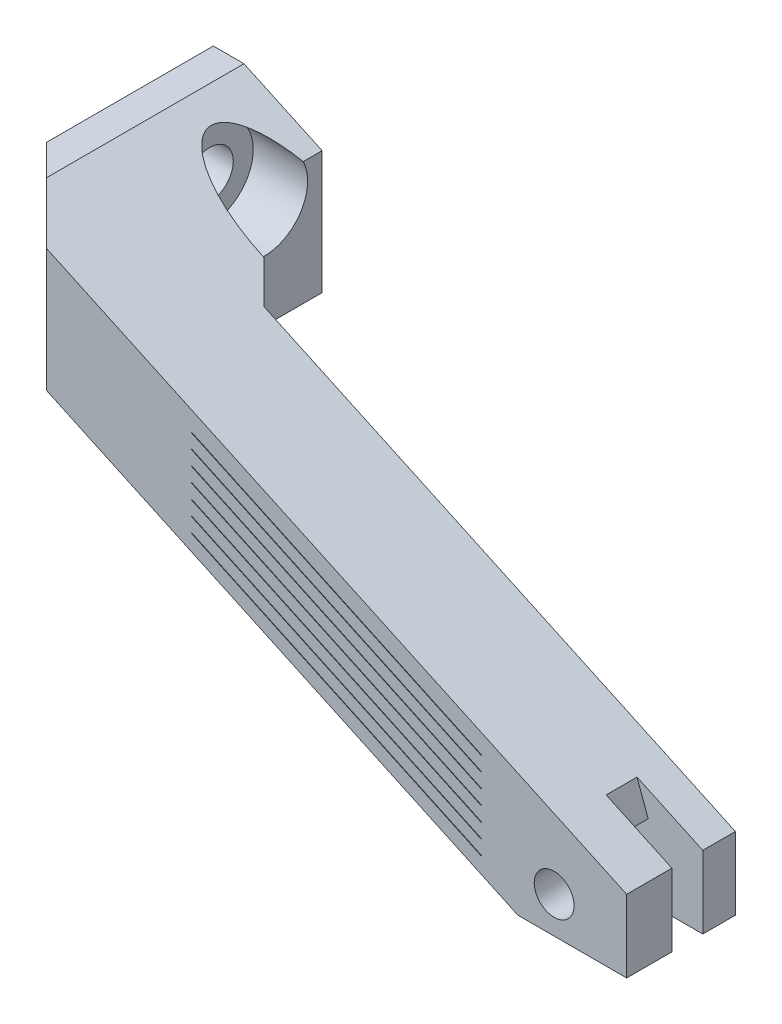
from build123d import *

# Parameters (mm, degrees)
BOSS_EXTRUDE1_DEPTH      = 10
BOSS_EXTRUDE1_DEPTH_BACK = 23
SKETCH2_W                = 75
SKETCH2_H                = 18
CUT_EXTRUDE1_DEPTH       = 106.405673062
SKETCH3_W                = 4.26
SKETCH3_H                = 10
CUT_EXTRUDE2_DEPTH       = 103.075500294
CHAMFER1_SIZE            = 10
SKETCH4_R                = 2.75
CUT_EXTRUDE3_DEPTH       = 105.782669179
CUT_EXTRUDE4_DEPTH       = 90.13140726
CUT_EXTRUDE4_DEPTH_BACK  = 90.13140726
SKETCH5_R                = 3.25
SKETCH6_R                = 6
CUT_EXTRUDE5_DEPTH       = 96.528308685
CHAMFER2_SIZE            = 10
CHAMFER2_SIZE2           = 7.529686928
CUT_EXTRUDE6_DEPTH       = 102.066353255


with BuildPart() as part:
    # Sketch1 → Boss-Extrude1 (new, two sides: drawn at the far end of the back side and taken through both)
    with BuildSketch(Plane.XY.offset(-BOSS_EXTRUDE1_DEPTH_BACK)):
        Polygon((0, -7.5), (0, 7.5), (4.228226943, 7.5), (90, -32.313210233), (90, -42.313210233), (75, -42.313210233), align=None)
    extrude(amount=BOSS_EXTRUDE1_DEPTH + BOSS_EXTRUDE1_DEPTH_BACK)

    # Sketch2 → Cut-Extrude1 (cut, through all)
    with BuildSketch(Plane(origin=(0, 7.5, 0), x_dir=(1, 0, 0), z_dir=(0, 1, 0))):
        with Locations((52.5, 14)):
            Rectangle(SKETCH2_W, SKETCH2_H)
    extrude(amount=-CUT_EXTRUDE1_DEPTH, mode=Mode.SUBTRACT)

    # Sketch3 → Cut-Extrude2 (cut, through all)
    with BuildSketch(Plane(origin=(90, 0, 0), x_dir=(0, 0, -1), z_dir=(1, 0, 0))):
        with Locations((-1.63, -37.313210233)):
            Rectangle(SKETCH3_W, SKETCH3_H)
    extrude(amount=-CUT_EXTRUDE2_DEPTH, mode=Mode.SUBTRACT)

    # Chamfer1
    chamfer1_edges = [part.edges().sort_by_distance(p)[0] for p in [
        (15, -5.981321023, -5),
        (0, 0, 10),
    ]]
    chamfer(chamfer1_edges, length=CHAMFER1_SIZE)

    # Sketch4 → Cut-Extrude3 (cut, through all)
    with BuildSketch(Plane.XY.offset(10)):
        with Locations((80, -37.313210233)):
            Circle(SKETCH4_R)
    extrude(amount=-CUT_EXTRUDE3_DEPTH, mode=Mode.SUBTRACT)

    # Sketch5 → Cut-Extrude4 (cut, two sides: drawn at the far end of the back side and taken through both)
    with BuildSketch(Plane(origin=(15, 0, 0), x_dir=(0, 0, -1), z_dir=(1, 0, 0)).offset(-CUT_EXTRUDE4_DEPTH_BACK)):
        with Locations((15, -0.11657101)):
            Circle(SKETCH5_R)
    extrude(amount=CUT_EXTRUDE4_DEPTH + CUT_EXTRUDE4_DEPTH_BACK, mode=Mode.SUBTRACT)

    # Sketch6 → Cut-Extrude5 (cut, through all)
    with BuildSketch(Plane(origin=(7.5, 0, 0), x_dir=(0, 0, -1), z_dir=(1, 0, 0))):
        with Locations(Location((15, -0.11657101, 0), (0, 0, 181.598775169))):
            Circle(SKETCH6_R)
    extrude(amount=CUT_EXTRUDE5_DEPTH, mode=Mode.SUBTRACT)

    # Chamfer2
    chamfer2_edges = [part.edges().sort_by_distance(p)[0] for p in [
        (90, -32.313210233, 1.63),
    ]]
    chamfer2_side = [part.faces().sort_by_distance(p)[0] for p in [
        (43.268675536, -10.621644592, 0.683427775),
    ]]
    chamfer(chamfer2_edges, length=CHAMFER2_SIZE, length2=CHAMFER2_SIZE2, reference=chamfer2_side[0])

    # Sketch7 → Cut-Extrude6 (cut, through all)
    with BuildSketch(Plane(origin=(0, 0, -5), x_dir=(-1, 0, 0), z_dir=(0, 0, -1))):
        Polygon((-30, -19.12032651), (-70, -37.687371968), (-70, -37.787371968), (-30, -19.22032651), align=None)
        Polygon((-30, -17.12032651), (-70, -35.687371968), (-70, -35.787371968), (-30, -17.22032651), align=None)
        Polygon((-30, -15.12032651), (-70, -33.687371968), (-70, -33.787371968), (-30, -15.22032651), align=None)
        Polygon((-30, -13.12032651), (-70, -31.687371968), (-70, -31.787371968), (-30, -13.22032651), align=None)
        Polygon((-30, -11.12032651), (-70, -29.687371968), (-70, -29.787371968), (-30, -11.22032651), align=None)
        Polygon((-30, -9.12032651), (-70, -27.687371968), (-70, -27.787371968), (-30, -9.22032651), align=None)
        Polygon((-30, -7.12032651), (-70, -25.687371968), (-70, -25.787371968), (-30, -7.22032651), align=None)
    extrude(amount=-CUT_EXTRUDE6_DEPTH, mode=Mode.SUBTRACT)


solid = part.part
